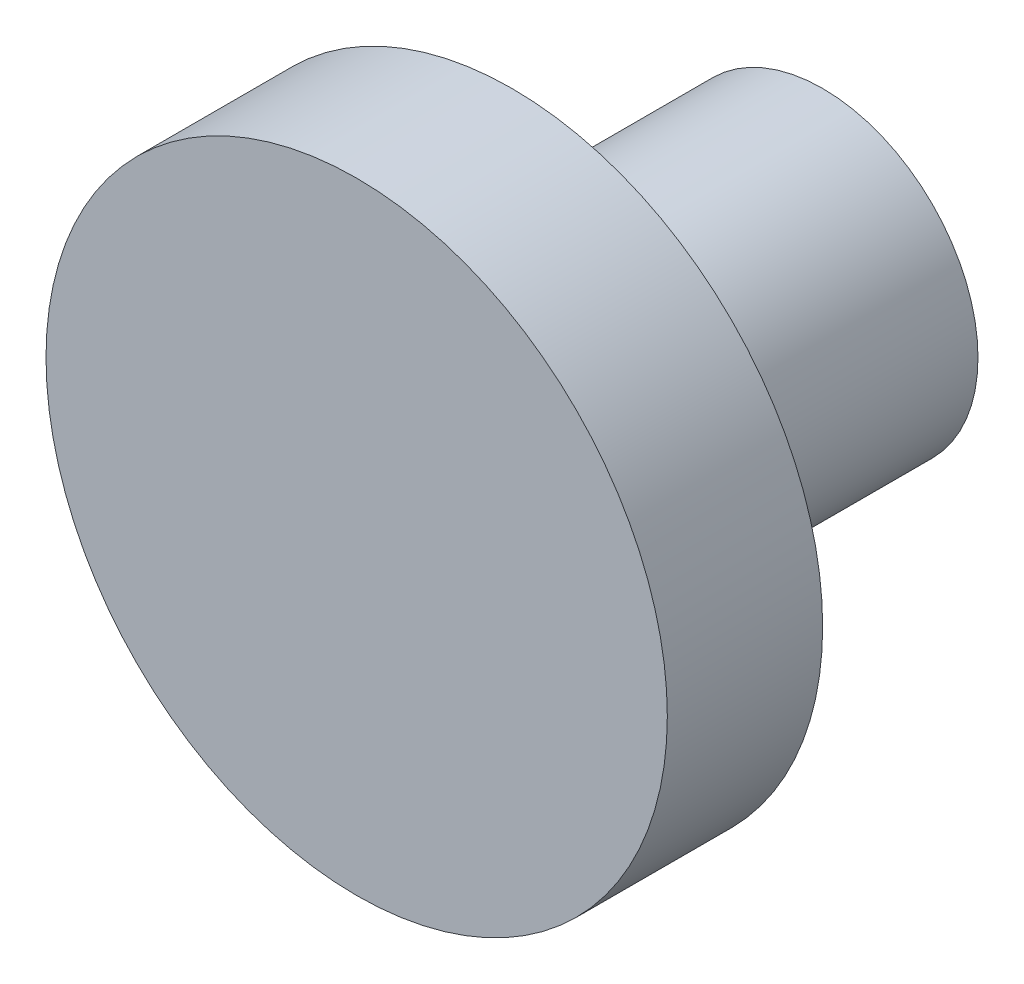
from build123d import *

# Parameters (mm, degrees)
SKETCH1_R           = 20
BOSS_EXTRUDE2_DEPTH = 10
SKETCH3_R           = 10
BOSS_EXTRUDE3_DEPTH = 20


with BuildPart() as part:
    # Sketch1 → Boss-Extrude2 (new body)
    with BuildSketch(Plane.XY):
        Circle(SKETCH1_R)
    extrude(amount=BOSS_EXTRUDE2_DEPTH)

    # Sketch3 → Boss-Extrude3 (add)
    with BuildSketch(Plane(origin=(0, 0, 0), x_dir=(-1, 0, 0), z_dir=(0, 0, -1))):
        with Locations(Location((0, 0, 0), (0, 0, 180))):
            Circle(SKETCH3_R)
    extrude(amount=BOSS_EXTRUDE3_DEPTH)


solid = part.part
